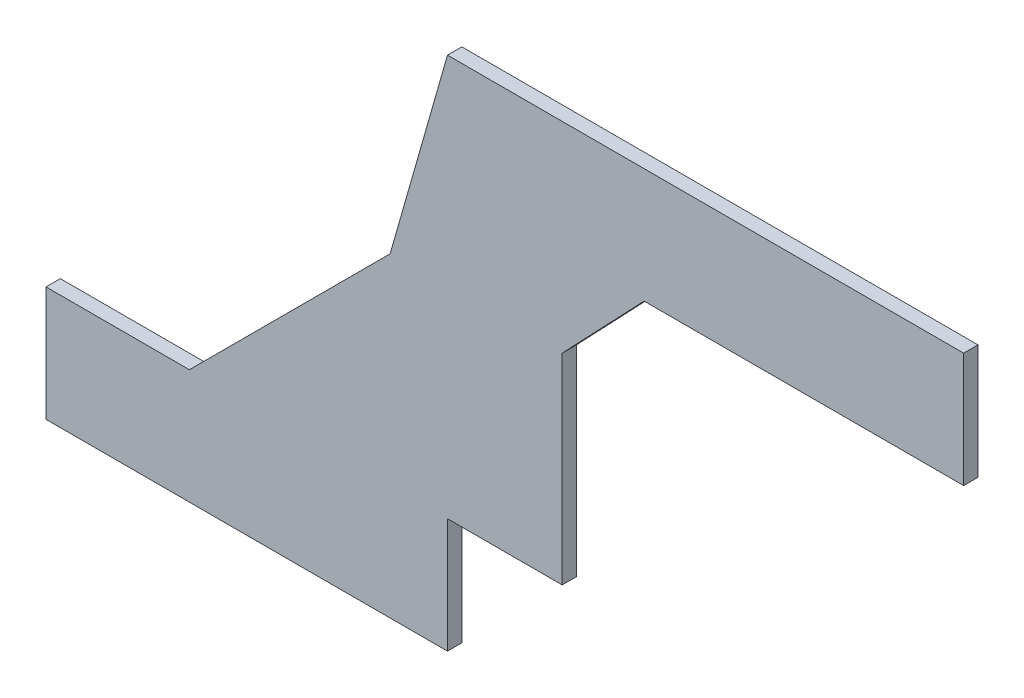
from build123d import *

# Parameters (mm, degrees)
BOSS_EXTRUDE1_DEPTH = 3.175


with BuildPart() as part:
    # Sketch1 → Boss-Extrude1 (new body)
    with BuildSketch(Plane.XY):
        Polygon((0, -12.7), (88.9, -12.7), (88.9, 12.7), (114.3, 12.7), (114.3, 57.15), (132.442857143, 76.2), (203.2, 76.2), (203.2, 101.6), (88.9, 101.6), (76.2, 57.15), (31.75, 12.7), (0, 12.7), align=None)
    extrude(amount=BOSS_EXTRUDE1_DEPTH)


solid = part.part
